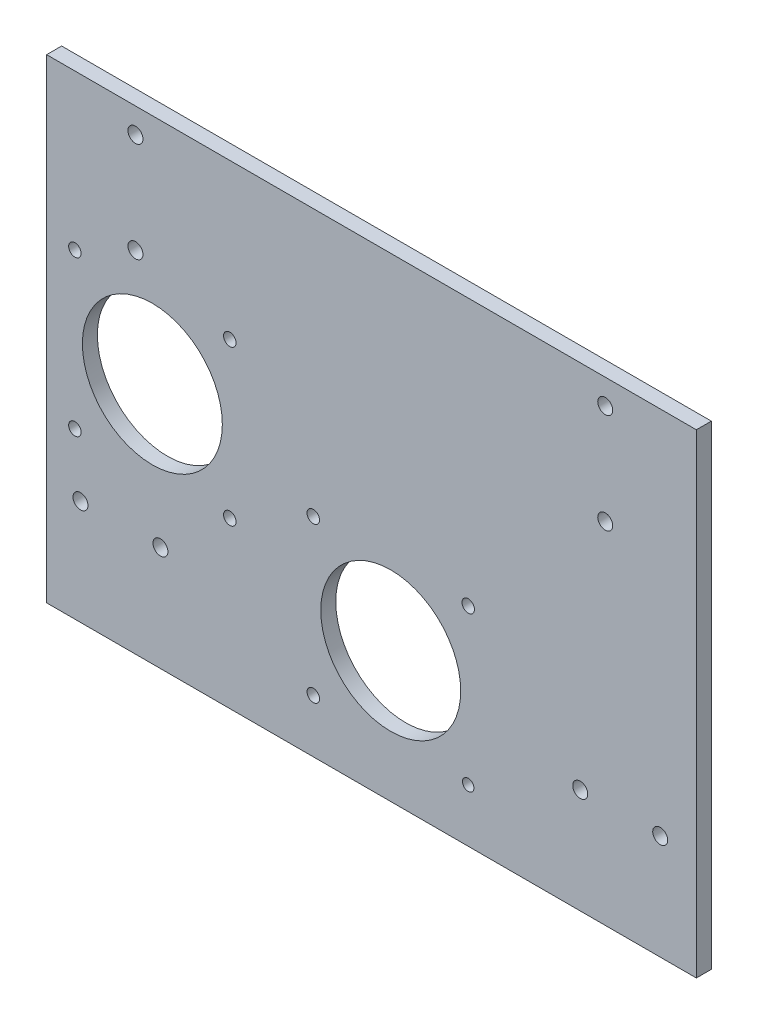
from build123d import *

# Parameters (mm, degrees)
SKETCH_1_W          = 130
SKETCH_1_H          = 95
EXTRUDE_1_DEPTH     = 3
SKETCH_3_R          = 1.5
CUT_EXTRUDE_2_DEPTH = 10
SKETCH_4_R          = 1.5
CUT_EXTRUDE_3_DEPTH = 10
SKETCH_5_R          = 14
CUT_EXTRUDE_4_DEPTH = 10
SKETCH_6_R          = 1.25
SKETCH_6_R_2        = 1.145522231
CUT_EXTRUDE_5_DEPTH = 10


with BuildPart() as part:
    # 草图1 → 凸台-拉伸1 (new body)
    with BuildSketch(Plane.XY):
        Rectangle(SKETCH_1_W, SKETCH_1_H)
    extrude(amount=EXTRUDE_1_DEPTH)

    # 草图3 → 切除-拉伸2 (cut)
    with BuildSketch(Plane(origin=(0, 0, 0), x_dir=(-1, 0, 0), z_dir=(0, 0, -1))):
        with Locations((-57.767112616, -26.5)):
            Circle(SKETCH_3_R)
        with Locations((-41.767112616, -26.5)):
            Circle(SKETCH_3_R)
        with Locations((42.232887384, -26.5)):
            Circle(SKETCH_3_R)
        with Locations((58.232887384, -26.5)):
            Circle(SKETCH_3_R)
    extrude(amount=-CUT_EXTRUDE_2_DEPTH, mode=Mode.SUBTRACT)

    # 草图4 → 切除-拉伸3 (cut)
    with BuildSketch(Plane(origin=(0, 0, 0), x_dir=(-1, 0, 0), z_dir=(0, 0, -1))):
        with Locations((-46.767112616, 42.5)):
            Circle(SKETCH_4_R)
        with Locations((-46.767112616, 22.5)):
            Circle(SKETCH_4_R)
        with Locations((47.232887384, 42.5)):
            Circle(SKETCH_4_R)
        with Locations((47.232887384, 22.5)):
            Circle(SKETCH_4_R)
    extrude(amount=-CUT_EXTRUDE_3_DEPTH, mode=Mode.SUBTRACT)

    # 草图5 → 切除-拉伸4 (cut)
    with BuildSketch(Plane(origin=(0, 0, 0), x_dir=(-1, 0, 0), z_dir=(0, 0, -1))):
        with Locations((-3.85, -21.35)):
            Circle(SKETCH_5_R)
        with Locations((43.85, 0.996699625)):
            Circle(SKETCH_5_R)
    extrude(amount=-CUT_EXTRUDE_4_DEPTH, mode=Mode.SUBTRACT)

    # 草图6 → 切除-拉伸5 (cut)
    with BuildSketch(Plane.XY.offset(3)):
        with Locations((-59.35, 16.496699625)):
            Circle(SKETCH_6_R)
        with Locations((-28.35, 16.496699625)):
            Circle(SKETCH_6_R)
        with Locations((-59.35, -14.503300375)):
            Circle(SKETCH_6_R)
        with Locations((-28.35, -14.503300375)):
            Circle(SKETCH_6_R)
        with Locations((-11.65, -5.85)):
            Circle(SKETCH_6_R)
        with Locations((19.35, -5.85)):
            Circle(SKETCH_6_R)
        with Locations((19.35, -36.85)):
            Circle(SKETCH_6_R_2)
        with Locations((-11.65, -36.85)):
            Circle(SKETCH_6_R)
    extrude(amount=-CUT_EXTRUDE_5_DEPTH, mode=Mode.SUBTRACT)


solid = part.part
